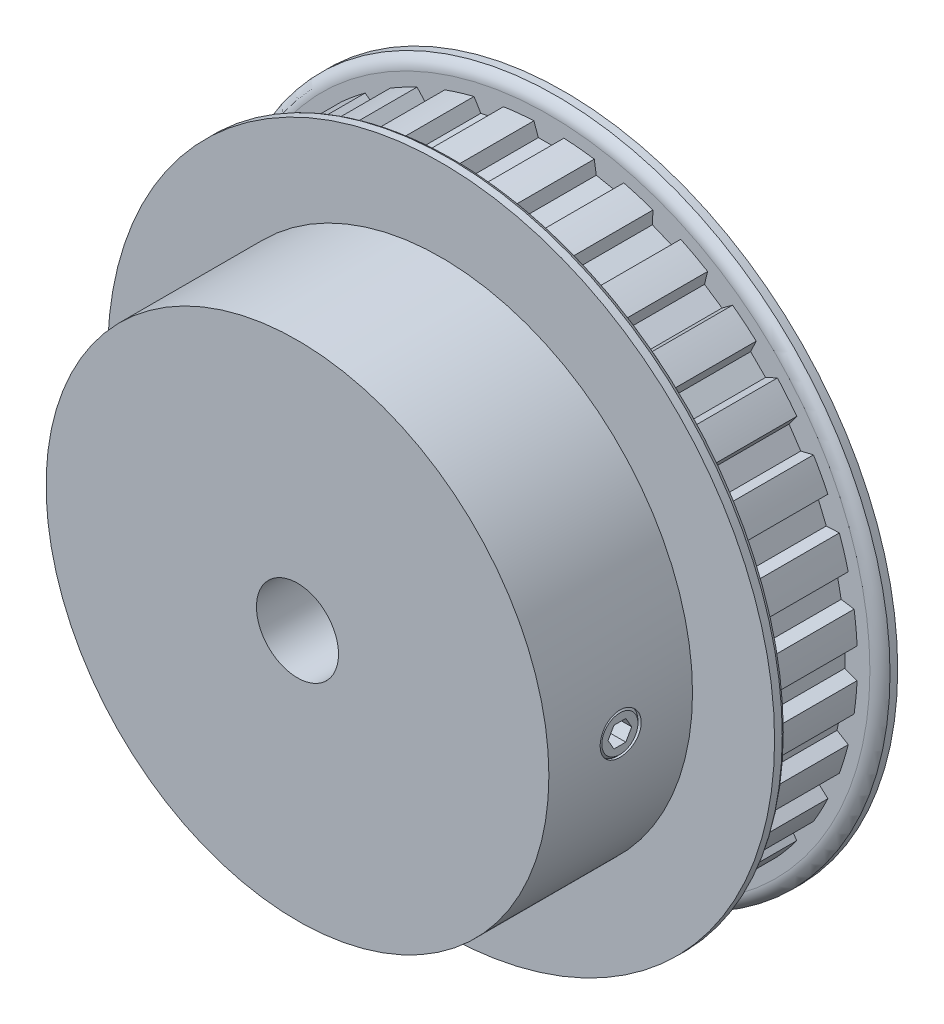
from build123d import *

# Parameters (mm, degrees)
CUT_EXTRUDE1_START = -3.9624
CUT_EXTRUDE1_DEPTH = 14.3002
CIRPATTERN1_COUNT  = 32
SKETCH4_R          = 3.175
CUT_EXTRUDE2_DEPTH = 76.835658145
CUT_EXTRUDE3_DEPTH = 2.38125


with BuildPart() as part:
    # Sketch2 → Revolve1 (revolve)
    with BuildSketch(Plane(origin=(0, 0, 0), x_dir=(0, 0, -1), z_dir=(1, 0, 0)), mode=Mode.PRIVATE) as revolve1_sk:
        with BuildLine():
            Line((-20.6375, 6.35), (20.6375, 6.35))
            Line((20.6375, 6.35), (20.6375, 51.6001))
            Line((20.6375, 51.6001), (19.45005, 51.6001))
            ThreePointArc((19.45005, 51.6001), (18.583289275, 50.804555278), (18.2626, 49.672599471))
            Line((18.2626, 49.672599471), (18.2626, 47.745098943))
            Line((18.2626, 47.745098943), (3.9624, 47.745098943))
            Line((3.9624, 47.745098943), (3.9624, 49.672599471))
            ThreePointArc((3.9624, 49.672599471), (3.641710725, 50.804555278), (2.77495, 51.6001))
            Line((2.77495, 51.6001), (1.5875, 51.6001))
            Line((1.5875, 51.6001), (1.5875, 38.9001))
            Line((1.5875, 38.9001), (-20.6375, 38.9001))
            Line((-20.6375, 38.9001), (-20.6375, 6.35))
        make_face()
    revolve(revolve1_sk.sketch.rotate(Axis((0, 0, 20.6375), (0, 0, -1)), 90), axis=Axis((0, 0, 20.6375), (0, 0, -1)))

    # Sketch3 → Cut-Extrude1 (cut)
    with BuildSketch(Plane.XY.offset(CUT_EXTRUDE1_START)):
        with BuildLine():
            Line((-1.630736704, 45.7835), (1.630736704, 45.7835))
            Line((1.630736704, 45.7835), (2.3241, 47.6885))
            ThreePointArc((2.3241, 47.6885), (0, 47.745098943), (-2.3241, 47.6885))
            Line((-2.3241, 47.6885), (-1.630736704, 45.7835))
        make_face()
    cut_extrude1 = extrude(amount=-CUT_EXTRUDE1_DEPTH, mode=Mode.SUBTRACT)

    # CirPattern1: Cut-Extrude1 ×32 about axis
    cirpattern1_axis = Axis((0, 0, 0), (0, 0, 1))
    for i in range(1, CIRPATTERN1_COUNT):
        add(cut_extrude1.rotate(cirpattern1_axis, i * 360 / CIRPATTERN1_COUNT), mode=Mode.SUBTRACT)

    # Sketch4 → Cut-Extrude2 (cut, through all)
    with BuildSketch(Plane(origin=(0, 0, 0), x_dir=(0, -1, 0), z_dir=(1, 0, 0))):
        with Locations(Location((0, -9.525, 0), (0, 0, 270))):
            Circle(SKETCH4_R)
    extrude(amount=CUT_EXTRUDE2_DEPTH, mode=Mode.SUBTRACT)

    # Sketch5 → Revolve2 (revolve)
    with BuildSketch(Plane.XY.offset(9.525)):
        Polygon((6.35, -2.794), (6.35, 0), (38.770312805, 0), (38.770312805, -2.794), (38.389312805, -3.175), (6.731, -3.175), align=None)
    revolve(axis=Axis((6.35, 0, 9.525), (1, 0, 0)))

    # Sketch6 → Cut-Extrude3 (cut)
    with BuildSketch(Plane(origin=(38.770312805, 5.384140679, 0), x_dir=(0, -1, 0), z_dir=(-1, 0, 0))):
        Polygon((5.384140679, 11.358087105), (3.796640679, 10.441543552), (3.796640679, 8.608456448), (5.384140679, 7.691912895), (6.971640679, 8.608456448), (6.971640679, 10.441543552), align=None)
    extrude(amount=CUT_EXTRUDE3_DEPTH, mode=Mode.SUBTRACT)


solid = part.part
